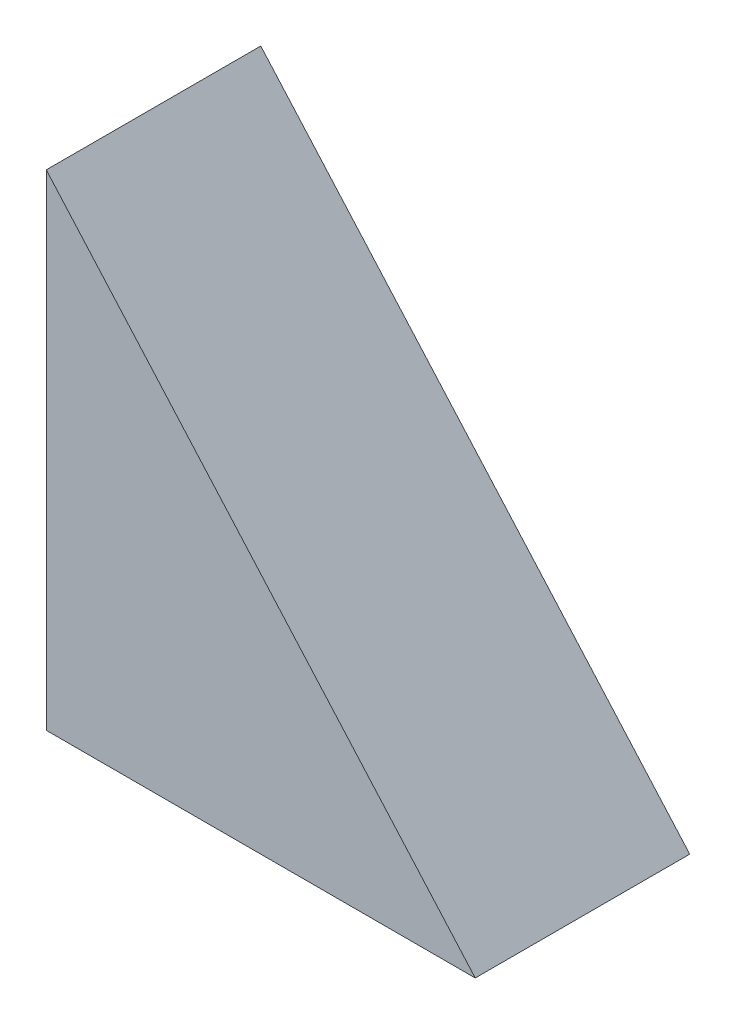
from build123d import *

# Parameters (mm, degrees)
BOSS_EXTRUDE1_DEPTH = 4.826


with BuildPart() as part:
    # Sketch1 → Boss-Extrude1 (new body)
    with BuildSketch(Plane.XY):
        Polygon((0, 0), (9.652, 0), (0, 10.922), align=None)
    extrude(amount=BOSS_EXTRUDE1_DEPTH)


solid = part.part
